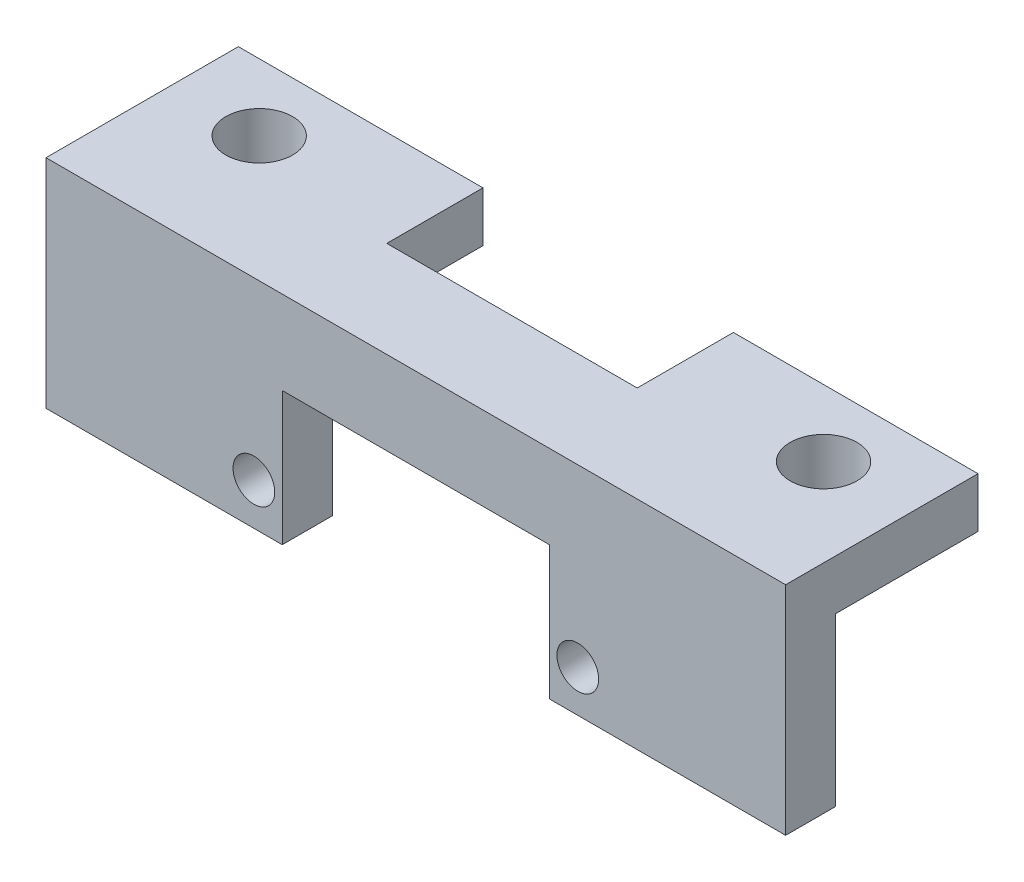
from build123d import *

# Parameters (mm, degrees)
ESBO_O1_R                = 2
RESSALTO_EXTRUS_O1_DEPTH = 3
ESBO_O2_W                = 44.3
ESBO_O2_H                = 3
RESSALTO_EXTRUS_O2_DEPTH = 10
ESBO_O3_R                = 1.25
ESBO_O3_W                = 16
ESBO_O3_H                = 8
CORTE_EXTRUS_O1_DEPTH    = 3


with BuildPart() as part:
    # Esboço1 → Ressalto-extrusão1 (new body)
    with BuildSketch(Plane(origin=(0, 0, 0), x_dir=(1, 0, 0), z_dir=(0, 1, 0))):
        Polygon((22.15, 5.76), (7.5, 5.76), (7.5, 0), (-7.5, 0), (-7.5, 5.76), (-22.15, 5.76), (-22.15, -5.76), (22.15, -5.76), align=None)
        with Locations(Location((-16.9, 1.76, 0), (0, 0, 270))):
            Circle(ESBO_O1_R, mode=Mode.SUBTRACT)
        with Locations(Location((16.9, 1.76, 0), (0, 0, 90))):
            Circle(ESBO_O1_R, mode=Mode.SUBTRACT)
    extrude(amount=RESSALTO_EXTRUS_O1_DEPTH)

    # Esboço2 → Ressalto-extrusão2 (add)
    with BuildSketch(Plane(origin=(0, 0, 0), x_dir=(-1, 0, 0), z_dir=(0, -1, 0))):
        with Locations((0, -4.26)):
            Rectangle(ESBO_O2_W, ESBO_O2_H)
    extrude(amount=RESSALTO_EXTRUS_O2_DEPTH)

    # Esboço3 → Corte-extrusão1 (cut)
    with BuildSketch(Plane.XY.offset(5.76)):
        with Locations((-9.7, -7.5)):
            Circle(ESBO_O3_R)
        with Locations((9.7, -7.5)):
            Circle(ESBO_O3_R)
        with Locations((0, -6)):
            Rectangle(ESBO_O3_W, ESBO_O3_H)
    extrude(amount=-CORTE_EXTRUS_O1_DEPTH, mode=Mode.SUBTRACT)


solid = part.part
